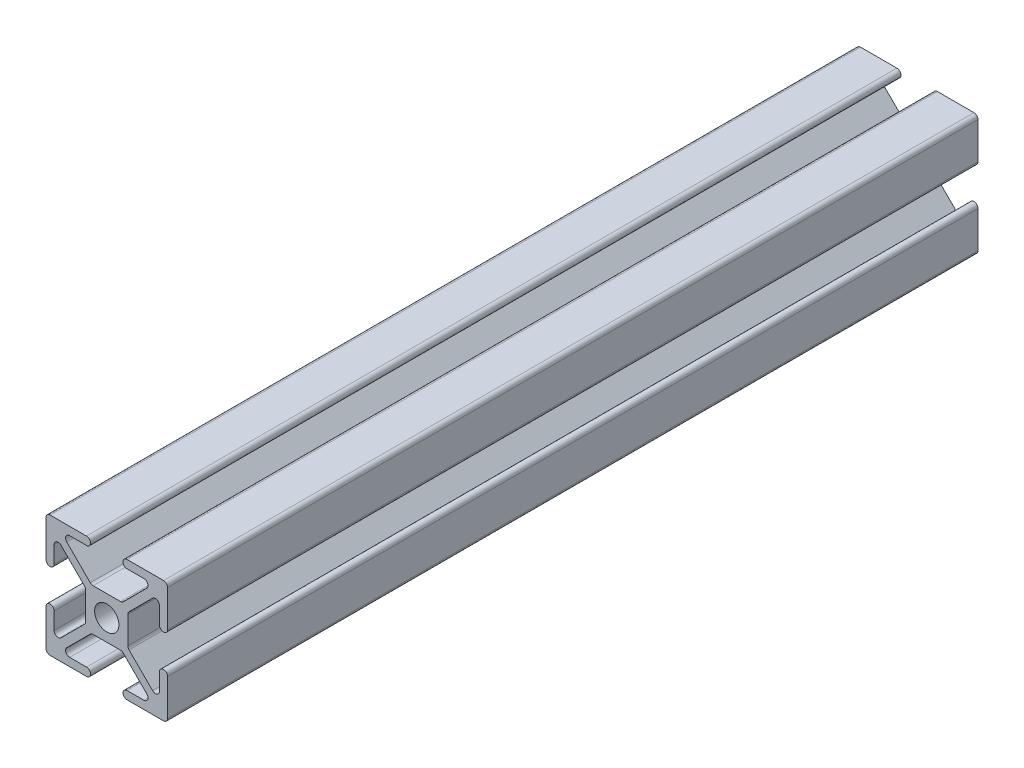
from build123d import *

# Parameters (mm, degrees)
SALIENTE_EXTRUIR1_DEPTH = 200
CROQUIS2_R              = 3
CORTAR_EXTRUIR1_DEPTH   = 202.121853611
CORTAR_EXTRUIR3_DEPTH   = 202.121853611


with BuildPart() as part:
    # Croquis1 → Saliente-Extruir1 (new body)
    with BuildSketch(Plane.XY):
        with BuildLine():
            Line((-14, 15), (14, 15))
            ThreePointArc((14, 15), (14.707106781, 14.707106781), (15, 14))
            Line((15, 14), (15, -14))
            ThreePointArc((15, -14), (14.707106781, -14.707106781), (14, -15))
            Line((14, -15), (-14, -15))
            ThreePointArc((-14, -15), (-14.707106781, -14.707106781), (-15, -14))
            Line((-15, -14), (-15, 14))
            ThreePointArc((-15, 14), (-14.707106781, 14.707106781), (-14, 15))
        make_face()
    extrude(amount=-SALIENTE_EXTRUIR1_DEPTH)

    # Croquis2 → Cortar-Extruir1 (cut, through all)
    with BuildSketch(Plane.XY):
        Circle(CROQUIS2_R)
    extrude(amount=-CORTAR_EXTRUIR1_DEPTH, mode=Mode.SUBTRACT)

    # Croquis3 → Cortar-Extruir3 (cut, through all)
    with BuildSketch(Plane.XY):
        with BuildLine():
            Line((-5.492893219, 4.078679656), (-11.292893219, 9.878679656))
            ThreePointArc((-11.292893219, 9.878679656), (-12.382683432, 10.095452408), (-13, 9.171572875))
            Line((-13, 9.171572875), (-13, 5))
            ThreePointArc((-13, 5), (-14, 4), (-15, 5))
            Line((-15, 5), (-15, -5))
            ThreePointArc((-15, -5), (-14, -4), (-13, -5))
            Line((-13, -5), (-13, -9.171572875))
            ThreePointArc((-13, -9.171572875), (-12.382683432, -10.095452408), (-11.292893219, -9.878679656))
            Line((-11.292893219, -9.878679656), (-5.492893219, -4.078679656))
            ThreePointArc((-5.492893219, -4.078679656), (-5.276120467, -3.754256308), (-5.2, -3.371572875))
            Line((-5.2, -3.371572875), (-5.2, 3.371572875))
            ThreePointArc((-5.2, 3.371572875), (-5.276120467, 3.754256308), (-5.492893219, 4.078679656))
        make_face()
        with BuildLine():
            ThreePointArc((-9.171572875, 13), (-10.095452408, 12.382683432), (-9.878679656, 11.292893219))
            Line((-9.878679656, 11.292893219), (-4.078679656, 5.492893219))
            ThreePointArc((-4.078679656, 5.492893219), (-3.754256308, 5.276120467), (-3.371572875, 5.2))
            Line((-3.371572875, 5.2), (3.371572875, 5.2))
            ThreePointArc((3.371572875, 5.2), (3.754256308, 5.276120467), (4.078679656, 5.492893219))
            Line((4.078679656, 5.492893219), (9.878679656, 11.292893219))
            ThreePointArc((9.878679656, 11.292893219), (10.095452408, 12.382683432), (9.171572875, 13))
            Line((9.171572875, 13), (5, 13))
            ThreePointArc((5, 13), (4, 14), (5, 15))
            Line((5, 15), (-5, 15))
            ThreePointArc((-5, 15), (-4.292893219, 14.707106781), (-4, 14))
            ThreePointArc((-4, 14), (-4.292893219, 13.292893219), (-5, 13))
            Line((-5, 13), (-9.171572875, 13))
        make_face()
        with BuildLine():
            Line((9.878679656, -11.292893219), (4.078679656, -5.492893219))
            ThreePointArc((4.078679656, -5.492893219), (3.754256308, -5.276120467), (3.371572875, -5.2))
            Line((3.371572875, -5.2), (-3.371572875, -5.2))
            ThreePointArc((-3.371572875, -5.2), (-3.754256308, -5.276120467), (-4.078679656, -5.492893219))
            Line((-4.078679656, -5.492893219), (-9.878679656, -11.292893219))
            ThreePointArc((-9.878679656, -11.292893219), (-10.095452408, -12.382683432), (-9.171572875, -13))
            Line((-9.171572875, -13), (-5, -13))
            ThreePointArc((-5, -13), (-4.292893219, -13.292893219), (-4, -14))
            ThreePointArc((-4, -14), (-4.292893219, -14.707106781), (-5, -15))
            Line((-5, -15), (5, -15))
            ThreePointArc((5, -15), (4, -14), (5, -13))
            Line((5, -13), (9.171572875, -13))
            ThreePointArc((9.171572875, -13), (10.095452408, -12.382683432), (9.878679656, -11.292893219))
        make_face()
        with BuildLine():
            ThreePointArc((13, 9.171572875), (12.382683432, 10.095452408), (11.292893219, 9.878679656))
            Line((11.292893219, 9.878679656), (5.492893219, 4.078679656))
            ThreePointArc((5.492893219, 4.078679656), (5.276120467, 3.754256308), (5.2, 3.371572875))
            Line((5.2, 3.371572875), (5.2, -3.371572875))
            ThreePointArc((5.2, -3.371572875), (5.276120467, -3.754256308), (5.492893219, -4.078679656))
            Line((5.492893219, -4.078679656), (11.292893219, -9.878679656))
            ThreePointArc((11.292893219, -9.878679656), (12.382683432, -10.095452408), (13, -9.171572875))
            Line((13, -9.171572875), (13, -5))
            ThreePointArc((13, -5), (14, -4), (15, -5))
            Line((15, -5), (15, 5))
            ThreePointArc((15, 5), (14, 4), (13, 5))
            Line((13, 5), (13, 9.171572875))
        make_face()
    extrude(amount=-CORTAR_EXTRUIR3_DEPTH, mode=Mode.SUBTRACT)


solid = part.part
